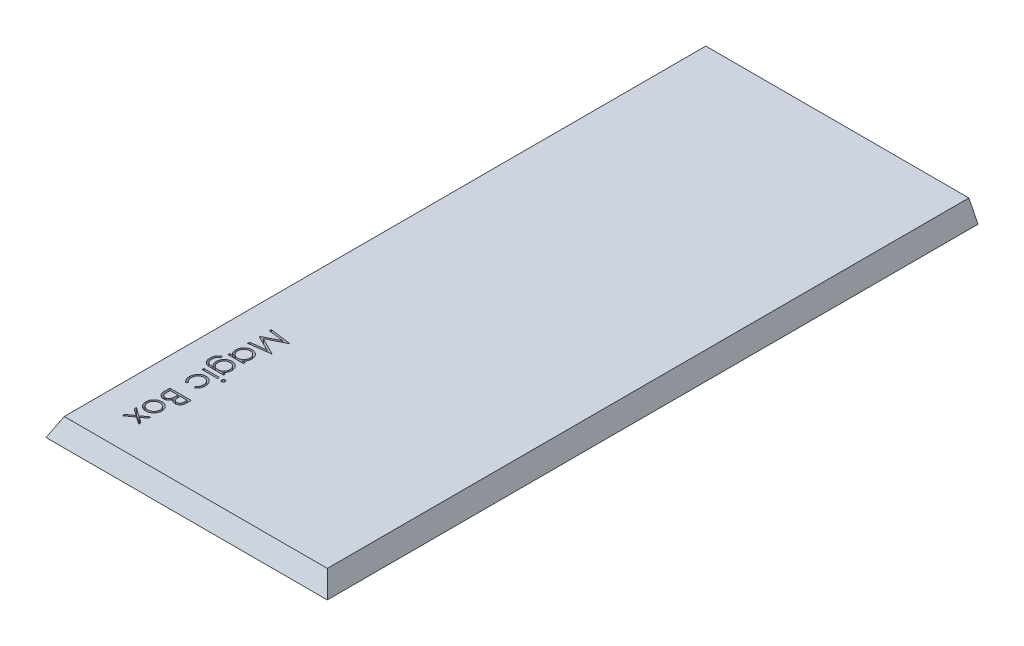
from build123d import *

# Parameters (mm, degrees)
SKETCH1_W           = 47
SKETCH1_H           = 107.5
BOSS_EXTRUDE1_DEPTH = 3
SKETCH2_W           = 2.557692308
SKETCH2_H           = 0.314102564
CUT_EXTRUDE2_DEPTH  = 1
CUT_EXTRUDE7_DEPTH  = 109
CUT_EXTRUDE10_DEPTH = 109


with BuildPart() as part:
    # Sketch1 → Boss-Extrude1 (new body)
    with BuildSketch(Plane(origin=(0, 0, 0), x_dir=(1, 0, 0), z_dir=(0, 1, 0))):
        with Locations((23.5, -53.75)):
            Rectangle(SKETCH1_W, SKETCH1_H)
    extrude(amount=BOSS_EXTRUDE1_DEPTH)

    # Sketch2 → Cut-Extrude2 (cut)
    # profile 1 of 9: a face of its own
    with BuildSketch(Plane(origin=(0, 3, 0), x_dir=(1, 0, 0), z_dir=(0, 1, 0))):
        Polygon((9.057692308, -98.570512821), (9.057692308, -98.944210737), (8.135016026, -99.602564103), (9.057692308, -100.260917468), (9.057692308, -100.634615385), (7.873497596, -99.789763622), (6.5, -100.769230769), (6.5, -100.395532853), (7.611278045, -99.602564103), (6.5, -98.809595353), (6.5, -98.435897436), (7.873497596, -99.416065705), align=None)
    # profile 2 of 9: a face of its own
    with BuildSketch(Plane(origin=(0, 3, 0), x_dir=(1, 0, 0), z_dir=(0, 1, 0))):
        with BuildLine():
            add(Edge.make_bspline(
                [(9.102564103, -96.844350962), (9.10154521, -96.892343426), (9.099547412, -96.986444919), (9.07808998, -97.124235935), (9.045551155, -97.255629662), (8.999748526, -97.381189741), (8.939653687, -97.499877535), (8.866981145, -97.612752731), (8.781239229, -97.71958918), (8.714875573, -97.783609539), (8.681189904, -97.816105769)],
                knots=[0, 0, 0, 0, 1.054042676, 2.066720093, 3.05716247, 4.025731183, 4.997454851, 5.974904663, 6.97207755, 8, 8, 8, 8], degree=3))
            add(Edge.make_bspline(
                [(8.681189904, -97.816105769), (8.648975918, -97.844087723), (8.585171376, -97.899510104), (8.481715763, -97.970575822), (8.374575662, -98.031797382), (8.262328336, -98.080860343), (8.145953664, -98.119545367), (8.025051653, -98.147011063), (7.899889306, -98.163347998), (7.814885468, -98.165550965), (7.771834936, -98.166666667)],
                knots=[0, 0, 0, 0, 1.025258237, 2.030674902, 3.01204498, 3.988269485, 4.97094183, 5.956517959, 6.965070386, 8, 8, 8, 8], degree=3))
            add(Edge.make_bspline(
                [(7.771834936, -98.166666667), (7.728534878, -98.165685329), (7.642971945, -98.163746161), (7.51695258, -98.145402544), (7.394757754, -98.11687146), (7.276899073, -98.076039616), (7.163016196, -98.023681529), (7.053606839, -97.959790755), (6.948453965, -97.883919473), (6.848454996, -97.797914177), (6.75627808, -97.702867146), (6.675988565, -97.599733449), (6.606912047, -97.49046507), (6.552046085, -97.373570388), (6.507820299, -97.250713362), (6.477323772, -97.121112544), (6.458720064, -96.984883549), (6.456342333, -96.891854093), (6.455128205, -96.844350962)],
                knots=[0, 0, 0, 0, 0.998669827, 1.973418153, 2.932281609, 3.89081133, 4.846438734, 5.82045571, 6.809776312, 7.834649874, 8.860672198, 9.859676908, 10.845817165, 11.837296335, 12.833502054, 13.853824644, 14.904110009, 16, 16, 16, 16], degree=3))
            add(Edge.make_bspline(
                [(6.455128205, -96.844350962), (6.456352379, -96.796617378), (6.458749984, -96.703128742), (6.477185387, -96.566386787), (6.508146141, -96.436240309), (6.55149858, -96.312802141), (6.607362699, -96.195907933), (6.675719795, -96.086236079), (6.756318736, -95.983053735), (6.84844398, -95.887976906), (6.948456803, -95.8019796), (7.053606102, -95.726106256), (7.163016387, -95.662216017), (7.276899022, -95.609857791), (7.394757767, -95.569025984), (7.516952576, -95.540494889), (7.642971946, -95.522151275), (7.728534878, -95.520212107), (7.771834936, -95.519230769)],
                knots=[0, 0, 0, 0, 1.099861214, 2.154133753, 3.1731438, 4.178222029, 5.163564916, 6.153006591, 7.15072618, 8.175428628, 9.198983792, 10.187031731, 11.15979573, 12.114193814, 13.071490482, 14.029120454, 15.002614863, 16, 16, 16, 16], degree=3))
            add(Edge.make_bspline(
                [(7.771834936, -95.519230769), (7.814651482, -95.52035408), (7.899420884, -95.522578041), (8.024347945, -95.53889855), (8.145045334, -95.566257107), (8.26097081, -95.604988503), (8.372726246, -95.654503694), (8.480131077, -95.714864982), (8.583118877, -95.786655614), (8.646840957, -95.841857566), (8.679086538, -95.869791667)],
                knots=[0, 0, 0, 0, 1.031353054, 2.041901799, 3.029428768, 4.008703097, 4.981709435, 5.96992636, 6.972712378, 8, 8, 8, 8], degree=3))
            add(Edge.make_bspline(
                [(8.679086538, -95.869791667), (8.713058664, -95.902241594), (8.779870826, -95.966060087), (8.865443569, -96.073389708), (8.939095912, -96.185779355), (8.999160507, -96.305232726), (9.04546805, -96.431141933), (9.078241849, -96.563512205), (9.0994525, -96.701804752), (9.101516565, -96.796362025), (9.102564103, -96.844350962)],
                knots=[0, 0, 0, 0, 1.027951202, 2.021646915, 2.998468564, 3.9668038, 4.943370589, 5.93035926, 6.949632805, 8, 8, 8, 8], degree=3))
        make_face()
        with BuildLine():
            add(Edge.make_bspline(
                [(8.788461538, -96.842948718), (8.787496895, -96.809011145), (8.785592509, -96.742012091), (8.771109357, -96.643391957), (8.74815907, -96.548453836), (8.715565273, -96.457005495), (8.673427645, -96.369400624), (8.621963898, -96.285542833), (8.560899931, -96.205657417), (8.491449449, -96.130358069), (8.416014047, -96.06044067), (8.334897943, -96.000026534), (8.250428202, -95.94856042), (8.162166361, -95.905731049), (8.06927654, -95.873820955), (7.972795205, -95.850648721), (7.872529979, -95.836178268), (7.804368935, -95.834291919), (7.769731571, -95.833333333)],
                knots=[0, 0, 0, 0, 1.021589593, 2.016807015, 2.994807536, 3.958602519, 4.934347097, 5.916793557, 6.916107818, 7.957073844, 8.998039869, 10.008589932, 10.997041759, 11.972786337, 12.956492182, 13.948170289, 14.957322718, 16, 16, 16, 16], degree=3))
            add(Edge.make_bspline(
                [(7.769731571, -95.833333333), (7.724977566, -95.834935917), (7.636149235, -95.838116746), (7.505367193, -95.864114332), (7.379576721, -95.907297533), (7.260292369, -95.966844276), (7.14973484, -96.040177881), (7.050320988, -96.125926492), (6.965884611, -96.225275613), (6.894872197, -96.334842217), (6.838949987, -96.453073604), (6.798846326, -96.577987576), (6.773127506, -96.708446753), (6.770541049, -96.797722349), (6.769230769, -96.842948718)],
                knots=[0, 0, 0, 0, 1.016977094, 2.018509362, 3.018404954, 4.033172147, 5.041280572, 6.028085189, 7.007940189, 7.995502847, 8.989109012, 9.972200833, 10.97273166, 12, 12, 12, 12], degree=3))
            add(Edge.make_bspline(
                [(6.769230769, -96.842948718), (6.770533459, -96.888177688), (6.773104934, -96.977458419), (6.798976626, -97.108099114), (6.838775602, -97.233355435), (6.894935358, -97.351709753), (6.965616203, -97.461326253), (7.050802015, -97.559965953), (7.149473499, -97.64645302), (7.260145777, -97.719859238), (7.379762163, -97.778446518), (7.505344015, -97.821832798), (7.636155138, -97.847768034), (7.724979543, -97.850957279), (7.769731571, -97.852564103)],
                knots=[0, 0, 0, 0, 1.027082318, 2.027431966, 3.015401697, 4.008827937, 4.996211763, 5.971861488, 6.96198607, 7.969911943, 8.982141629, 9.981856156, 10.983207064, 12, 12, 12, 12], degree=3))
            add(Edge.make_bspline(
                [(7.769731571, -97.852564103), (7.8043717, -97.85161265), (7.872538187, -97.849740336), (7.972763828, -97.835167795), (8.069467367, -97.81235552), (8.161792021, -97.779048075), (8.250859277, -97.737688633), (8.334644294, -97.684970546), (8.416065613, -97.624837806), (8.491403982, -97.554792111), (8.561153687, -97.47950124), (8.621741455, -97.399015681), (8.673457034, -97.315118944), (8.715570463, -97.227486387), (8.748033616, -97.136244989), (8.771209332, -97.041595106), (8.785539702, -96.943411708), (8.787481364, -96.876650563), (8.788461538, -96.842948718)],
                knots=[0, 0, 0, 0, 1.043020522, 2.052505155, 3.044509714, 4.030878336, 5.003918577, 5.996372628, 7.007255355, 8.048564058, 9.08987276, 10.095126797, 11.077896669, 12.053962454, 13.01807471, 13.98956039, 14.985105429, 16, 16, 16, 16], degree=3))
        make_face(mode=Mode.SUBTRACT)
    # profile 3 of 9: a face of its own
    with BuildSketch(Plane(origin=(0, 3, 0), x_dir=(1, 0, 0), z_dir=(0, 1, 0))):
        with BuildLine():
            Line((10, -92.916666667), (10, -93.599559295))
            add(Edge.make_bspline(
                [(10, -93.599559295), (9.99982425, -93.632987773), (9.999483602, -93.697780483), (9.99420047, -93.791999925), (9.986996801, -93.880248736), (9.975566708, -93.962552508), (9.961774931, -94.038873211), (9.945073115, -94.109440848), (9.925046501, -94.17403102), (9.89320022, -94.251143757), (9.845877051, -94.339064417), (9.775948486, -94.43426281), (9.690416023, -94.515667049), (9.593933368, -94.585853367), (9.487797596, -94.641654486), (9.374538407, -94.682023784), (9.255616665, -94.707581659), (9.173973487, -94.710210093), (9.13271234, -94.711538462)],
                knots=[0, 0, 0, 0, 1.001505555, 1.941167018, 2.826882275, 3.653841531, 4.429895133, 5.150066043, 5.825578002, 6.45369114, 7.647487171, 8.808567382, 9.977351308, 11.170798116, 12.373658725, 13.556498008, 14.765093433, 16, 16, 16, 16], degree=3))
            add(Edge.make_bspline(
                [(9.13271234, -94.711538462), (9.094053235, -94.710466372), (9.018084448, -94.708359614), (8.907150679, -94.687527962), (8.801116128, -94.656512603), (8.701287981, -94.611487466), (8.608949247, -94.553571207), (8.52464869, -94.483875674), (8.450429264, -94.40089403), (8.409109541, -94.338622368), (8.388120994, -94.306991186)],
                knots=[0, 0, 0, 0, 1.044266239, 2.052081639, 3.041743201, 4.026043445, 5.00270663, 5.980942822, 6.97441044, 8, 8, 8, 8], degree=3))
            add(Edge.make_bspline(
                [(8.388120994, -94.306991186), (8.372867775, -94.346758272), (8.343684588, -94.42284256), (8.291808319, -94.527619875), (8.236021049, -94.618254577), (8.174776106, -94.69484643), (8.107935032, -94.759363213), (8.036836284, -94.817300623), (7.95797957, -94.865839183), (7.87361028, -94.907537897), (7.784320561, -94.940354348), (7.690518767, -94.963574141), (7.593253774, -94.977841573), (7.526957798, -94.97978708), (7.493489583, -94.980769231)],
                knots=[0, 0, 0, 0, 1.272302504, 2.434229863, 3.488457646, 4.447234501, 5.35599188, 6.26022912, 7.18267843, 8.11661068, 9.06895546, 10.019249207, 11.000057067, 12, 12, 12, 12], degree=3))
            add(Edge.make_bspline(
                [(7.493489583, -94.980769231), (7.459322905, -94.979792078), (7.392099008, -94.977869503), (7.293341106, -94.96369391), (7.198976329, -94.93966871), (7.10833373, -94.906656773), (7.021926377, -94.86332724), (6.938672091, -94.811733057), (6.86078871, -94.748936398), (6.786424081, -94.678940632), (6.719600708, -94.599662898), (6.660109352, -94.514140838), (6.610959363, -94.421144363), (6.570188246, -94.322115604), (6.538590839, -94.21639651), (6.516654453, -94.104379064), (6.501839273, -93.986038921), (6.500623494, -93.904828585), (6.5, -93.86318109)],
                knots=[0, 0, 0, 0, 0.978404568, 1.925038397, 2.85041836, 3.763147166, 4.682162379, 5.614488577, 6.562659439, 7.54271123, 8.535210642, 9.526693784, 10.520907202, 11.541451354, 12.589717429, 13.675358278, 14.807842563, 16, 16, 16, 16], degree=3))
            Line((6.5, -93.86318109), (6.5, -92.916666667))
            Line((6.5, -92.916666667), (10, -92.916666667))
        make_face()
        with BuildLine():
            Line((9.641025641, -93.230769231), (8.519230769, -93.230769231))
            Line((8.519230769, -93.230769231), (8.519230769, -93.441806891))
            add(Edge.make_bspline(
                [(8.519230769, -93.441806891), (8.519627364, -93.472655964), (8.520393667, -93.53226266), (8.522657945, -93.618811951), (8.528720383, -93.69894927), (8.535132411, -93.772950755), (8.545005621, -93.840320417), (8.557087658, -93.90128379), (8.569753809, -93.956388516), (8.591355012, -94.019907485), (8.622955643, -94.091937153), (8.673150423, -94.168235466), (8.731312009, -94.23659073), (8.799660574, -94.293666514), (8.874282065, -94.340764013), (8.955183134, -94.372194839), (9.039205431, -94.394488311), (9.097038901, -94.396443304), (9.126402244, -94.397435897)],
                knots=[0, 0, 0, 0, 1.156481963, 2.23455883, 3.244418989, 4.168404366, 5.01828131, 5.794834307, 6.498111525, 7.13526334, 8.307595709, 9.435046769, 10.546766856, 11.659452936, 12.760769924, 13.837671619, 14.902137667, 16, 16, 16, 16], degree=3))
            add(Edge.make_bspline(
                [(9.126402244, -94.397435897), (9.145837164, -94.39693946), (9.183960884, -94.395965643), (9.239322416, -94.387102753), (9.292056229, -94.374242613), (9.34094948, -94.35415115), (9.387391857, -94.32985642), (9.429320542, -94.298253384), (9.469032638, -94.262562842), (9.505070015, -94.220647774), (9.537359647, -94.172711135), (9.56577169, -94.118296178), (9.588183923, -94.056753159), (9.608288888, -93.989477498), (9.622239543, -93.915392507), (9.633904149, -93.835222098), (9.63983359, -93.748286159), (9.640619428, -93.688141232), (9.641025641, -93.657051282)],
                knots=[0, 0, 0, 0, 0.911752476, 1.788502045, 2.626783689, 3.45400582, 4.26402138, 5.080402872, 5.911472738, 6.767166405, 7.66795952, 8.620018292, 9.640966946, 10.73819047, 11.913090943, 13.176185384, 14.540321519, 16, 16, 16, 16], degree=3))
            Line((9.641025641, -93.657051282), (9.641025641, -93.230769231))
        make_face(mode=Mode.SUBTRACT)
        with BuildLine():
            Line((8.16025641, -93.230769231), (6.858974359, -93.230769231))
            Line((6.858974359, -93.230769231), (6.858974359, -93.678084936))
            add(Edge.make_bspline(
                [(6.858974359, -93.678084936), (6.859356766, -93.710104021), (6.860093805, -93.771816585), (6.862526199, -93.860915702), (6.867942779, -93.94327407), (6.876773248, -94.018939081), (6.885948875, -94.088576793), (6.898648387, -94.151495353), (6.913086196, -94.207791221), (6.93542939, -94.273059411), (6.970080688, -94.346602777), (7.022667742, -94.425801578), (7.084492161, -94.496918849), (7.156948104, -94.556618237), (7.235135085, -94.60591565), (7.31864416, -94.640490803), (7.404927716, -94.66272213), (7.463909533, -94.665349174), (7.493489583, -94.666666667)],
                knots=[0, 0, 0, 0, 1.159821618, 2.235403267, 3.228114831, 4.14795534, 4.994323282, 5.771256229, 6.471395042, 7.097801288, 8.267864287, 9.404187171, 10.531774336, 11.667624178, 12.792825787, 13.866573821, 14.930062559, 16, 16, 16, 16], degree=3))
            add(Edge.make_bspline(
                [(7.493489583, -94.666666667), (7.511985316, -94.666397375), (7.548678445, -94.665863136), (7.602559382, -94.657503195), (7.654984973, -94.645840532), (7.705162465, -94.628951993), (7.753908353, -94.607656914), (7.80037356, -94.580932398), (7.845669087, -94.550070645), (7.902867072, -94.501792666), (7.968791298, -94.431637775), (8.033326389, -94.331925284), (8.085374877, -94.2185546), (8.107474256, -94.136326877), (8.118890224, -94.09385016)],
                knots=[0, 0, 0, 0, 0.723503378, 1.435336582, 2.130201219, 2.824764462, 3.504949994, 4.209866579, 4.920640069, 5.648298893, 7.13757748, 8.670694625, 10.280166878, 12, 12, 12, 12], degree=3))
            add(Edge.make_bspline(
                [(8.118890224, -94.09385016), (8.122345541, -94.07682108), (8.129837379, -94.039898522), (8.137740616, -93.979690636), (8.144830077, -93.910724283), (8.14993647, -93.833294237), (8.155418093, -93.747092549), (8.157474037, -93.652146913), (8.159983424, -93.548390205), (8.160163087, -93.476397744), (8.16025641, -93.439002404)],
                knots=[0, 0, 0, 0, 0.634452549, 1.375623993, 2.216454381, 3.166361212, 4.209414599, 5.370755378, 6.634280627, 8, 8, 8, 8], degree=3))
            Line((8.16025641, -93.439002404), (8.16025641, -93.230769231))
        make_face(mode=Mode.SUBTRACT)
    # profile 4 of 9: a face of its own
    with BuildSketch(Plane(origin=(0, 3, 0), x_dir=(1, 0, 0), z_dir=(0, 1, 0))):
        with BuildLine():
            Line((8.503104968, -90.852564103), (8.33974359, -90.589643429))
            add(Edge.make_bspline(
                [(8.33974359, -90.589643429), (8.375575019, -90.560815173), (8.446103104, -90.504071645), (8.537069702, -90.405509438), (8.615517794, -90.300418537), (8.678593404, -90.186817465), (8.728385102, -90.065701546), (8.762989677, -89.93682126), (8.784740583, -89.800216373), (8.787200898, -89.706548292), (8.788461538, -89.658553686)],
                knots=[0, 0, 0, 0, 1.026629843, 2.020746545, 2.988156479, 3.951609825, 4.916760838, 5.907688704, 6.927920211, 8, 8, 8, 8], degree=3))
            add(Edge.make_bspline(
                [(8.788461538, -89.658553686), (8.787404632, -89.620194774), (8.785323084, -89.544647941), (8.772313503, -89.433741142), (8.748668193, -89.328101125), (8.717529159, -89.22705198), (8.675735107, -89.131362526), (8.625181733, -89.040764688), (8.565653632, -88.954955438), (8.497579651, -88.875297933), (8.422809808, -88.802702108), (8.343849662, -88.738497164), (8.260146373, -88.684909597), (8.173288589, -88.64024008), (8.081782059, -88.606631548), (7.986738455, -88.581916661), (7.887532367, -88.566851941), (7.820030561, -88.565026636), (7.785857372, -88.564102564)],
                knots=[0, 0, 0, 0, 1.11253269, 2.191102883, 3.232049486, 4.248096668, 5.252846381, 6.25411548, 7.252444123, 8.276484619, 9.287796331, 10.271127345, 11.222403915, 12.165070373, 13.097940083, 14.043161362, 15.009338842, 16, 16, 16, 16], degree=3))
            add(Edge.make_bspline(
                [(7.785857372, -88.564102564), (7.741086201, -88.565877797), (7.652147111, -88.569404344), (7.520898021, -88.597165293), (7.393761319, -88.642315875), (7.272436265, -88.705324275), (7.159946172, -88.783715683), (7.058232883, -88.875188615), (6.971531271, -88.981772447), (6.898968727, -89.100338856), (6.840401174, -89.22874701), (6.799073636, -89.365978994), (6.773989064, -89.510866168), (6.770837582, -89.610074661), (6.769230769, -89.660657051)],
                knots=[0, 0, 0, 0, 0.966447457, 1.919872872, 2.884287729, 3.873230387, 4.863319139, 5.838939256, 6.818209587, 7.819967013, 8.834377336, 9.85802846, 10.90789553, 12, 12, 12, 12], degree=3))
            add(Edge.make_bspline(
                [(6.769230769, -89.660657051), (6.770530266, -89.707012236), (6.773084123, -89.798112474), (6.794613087, -89.931279759), (6.82985672, -90.05805967), (6.87900437, -90.178447701), (6.942531886, -90.292223867), (7.020891057, -90.398653042), (7.111827657, -90.49985298), (7.182145629, -90.559349956), (7.217948718, -90.589643429)],
                knots=[0, 0, 0, 0, 1.039848629, 2.043578496, 3.018386758, 3.987534228, 4.954977003, 5.934852016, 6.948509513, 8, 8, 8, 8], degree=3))
            Line((7.217948718, -90.589643429), (7.045472756, -90.852564103))
            add(Edge.make_bspline(
                [(7.045472756, -90.852564103), (7.022582216, -90.836976267), (6.976877113, -90.805852334), (6.912430209, -90.753826697), (6.852119037, -90.697699367), (6.795961602, -90.637734126), (6.742972846, -90.574691993), (6.694654445, -90.506932006), (6.649783722, -90.435607715), (6.609120817, -90.360391883), (6.572649661, -90.282025269), (6.541087304, -90.200505483), (6.514401405, -90.116200775), (6.492808188, -90.029300585), (6.475725389, -89.939667779), (6.464363913, -89.847370614), (6.455890744, -89.752426362), (6.455384589, -89.688254302), (6.455128205, -89.655749199)],
                knots=[0, 0, 0, 0, 0.954067324, 1.904967979, 2.850944488, 3.791040077, 4.734579251, 5.686741025, 6.656553487, 7.63677735, 8.631289747, 9.633371755, 10.647134148, 11.676547777, 12.717490898, 13.789379914, 14.88025357, 16, 16, 16, 16], degree=3))
            add(Edge.make_bspline(
                [(6.455128205, -89.655749199), (6.456019485, -89.606138315), (6.4577664, -89.508900624), (6.476974874, -89.366578113), (6.505932495, -89.230564456), (6.547496211, -89.100906061), (6.601001052, -88.977582965), (6.666357724, -88.860709333), (6.744110425, -88.750675248), (6.832869742, -88.648557136), (6.929123096, -88.554802675), (7.032927558, -88.474180004), (7.14082011, -88.404625152), (7.254057284, -88.347264267), (7.373067504, -88.30393329), (7.496919148, -88.273094746), (7.62560932, -88.253460815), (7.713336996, -88.25116428), (7.7578125, -88.25)],
                knots=[0, 0, 0, 0, 1.112900083, 2.181292239, 3.217426397, 4.231060065, 5.231907716, 6.230057215, 7.231385915, 8.250448267, 9.26326716, 10.242335464, 11.195469137, 12.140906363, 13.085222324, 14.031808558, 15.002181388, 16, 16, 16, 16], degree=3))
            add(Edge.make_bspline(
                [(7.7578125, -88.25), (7.787986107, -88.250467846), (7.848006391, -88.251398469), (7.937210332, -88.261068641), (8.024834339, -88.275552302), (8.110752657, -88.296114353), (8.195225183, -88.32191637), (8.277800789, -88.354344549), (8.358959941, -88.392294733), (8.437703339, -88.436446985), (8.513554146, -88.485149819), (8.586080502, -88.538073343), (8.653424895, -88.596127551), (8.717272774, -88.658084288), (8.77571789, -88.724882208), (8.83128528, -88.795276889), (8.88109605, -88.871005462), (8.927609275, -88.950137881), (8.968951856, -89.032776383), (9.004589631, -89.118339341), (9.035040988, -89.206333368), (9.059150238, -89.296893241), (9.079367572, -89.389419488), (9.092085442, -89.484640806), (9.101071709, -89.582193033), (9.102062502, -89.648249055), (9.102564103, -89.681690705)],
                knots=[0, 0, 0, 0, 0.991083503, 1.971428668, 2.944771278, 3.907728914, 4.872032831, 5.84458753, 6.820199395, 7.813689706, 8.808455339, 9.780676499, 10.761021664, 11.727616056, 12.70141294, 13.675300653, 14.672050164, 15.67696011, 16.690052069, 17.705469636, 18.720567748, 19.746988726, 20.783187267, 21.830086354, 22.901455311, 24, 24, 24, 24], degree=3))
            add(Edge.make_bspline(
                [(9.102564103, -89.681690705), (9.101642457, -89.723570931), (9.099803771, -89.807122045), (9.08432148, -89.931061004), (9.06099875, -90.053182772), (9.026375122, -90.171305473), (8.984767812, -90.28394002), (8.93714288, -90.389169575), (8.88318024, -90.485344205), (8.823192746, -90.57335735), (8.755871557, -90.653558441), (8.680053861, -90.726807101), (8.596198315, -90.794640343), (8.534392181, -90.833096836), (8.503104968, -90.852564103)],
                knots=[0, 0, 0, 0, 1.095247575, 2.185020588, 3.262981163, 4.344680461, 5.40090428, 6.402280576, 7.363136638, 8.282296962, 9.184898179, 10.097200524, 11.036773704, 12, 12, 12, 12], degree=3))
        make_face()
    # profile 5 of 9: a face of its own
    with BuildSketch(Plane(origin=(0, 3, 0), x_dir=(1, 0, 0), z_dir=(0, 1, 0))):
        with BuildLine():
            add(Edge.make_bspline(
                [(10.134615385, -87.463341346), (10.13370731, -87.482829408), (10.131929126, -87.520990775), (10.116823357, -87.576230268), (10.090827583, -87.626479065), (10.057084436, -87.671713656), (10.015769317, -87.709211052), (9.96882621, -87.736098682), (9.91772133, -87.753263662), (9.882112539, -87.755348675), (9.863982372, -87.756410256)],
                knots=[0, 0, 0, 0, 1.054986045, 2.065865298, 3.074122704, 4.105114675, 5.109626121, 6.074217918, 7.019490725, 8, 8, 8, 8], degree=3))
            add(Edge.make_bspline(
                [(9.863982372, -87.756410256), (9.846322808, -87.755324927), (9.811411939, -87.753179358), (9.761193153, -87.73611137), (9.714903719, -87.708985631), (9.673669374, -87.671738614), (9.63994572, -87.626472473), (9.613944797, -87.576232012), (9.598840388, -87.520990316), (9.597062016, -87.482829252), (9.596153846, -87.463341346)],
                knots=[0, 0, 0, 0, 0.961106377, 1.899993565, 2.859409042, 3.870007927, 4.90724781, 5.921615355, 6.938620636, 8, 8, 8, 8], degree=3))
            add(Edge.make_bspline(
                [(9.596153846, -87.463341346), (9.597032849, -87.444077263), (9.598743713, -87.406582242), (9.614125508, -87.35235844), (9.639889179, -87.302918165), (9.674136064, -87.258423329), (9.714629537, -87.220437835), (9.761228119, -87.193412183), (9.811403037, -87.176298561), (9.846319817, -87.174159142), (9.863982372, -87.173076923)],
                knots=[0, 0, 0, 0, 1.055304112, 2.054011575, 3.063363921, 4.096942562, 5.122536081, 6.088009498, 7.032825006, 8, 8, 8, 8], degree=3))
            add(Edge.make_bspline(
                [(9.863982372, -87.173076923), (9.882115643, -87.174135278), (9.917730531, -87.176213954), (9.968790647, -87.193425465), (10.016045838, -87.220209634), (10.056618084, -87.258447872), (10.090884, -87.302911739), (10.116642695, -87.352360113), (10.13202579, -87.406581798), (10.133736474, -87.444077112), (10.134615385, -87.463341346)],
                knots=[0, 0, 0, 0, 0.986662878, 1.937868148, 2.908513651, 3.927890639, 4.955204348, 5.958438607, 6.951092507, 8, 8, 8, 8], degree=3))
        make_face()
    # profile 6 of 9: a face of its own
    with BuildSketch(Plane(origin=(0, 3, 0), x_dir=(1, 0, 0), z_dir=(0, 1, 0))):
        with Locations((7.778846154, -87.46474359)):
            Rectangle(SKETCH2_W, SKETCH2_H)
    # profile 7 of 9: a face of its own
    with BuildSketch(Plane(origin=(0, 3, 0), x_dir=(1, 0, 0), z_dir=(0, 1, 0))):
        with BuildLine():
            Line((9.057692308, -86.320512821), (9.057692308, -86.634615385))
            Line((9.057692308, -86.634615385), (7.027944712, -86.634615385))
            add(Edge.make_bspline(
                [(7.027944712, -86.634615385), (6.984707117, -86.634338342), (6.901248144, -86.633803583), (6.780569865, -86.629952612), (6.669103779, -86.621831935), (6.56634152, -86.612623253), (6.47275941, -86.599376537), (6.388078206, -86.58320017), (6.312216643, -86.564964491), (6.265491802, -86.548944273), (6.243389423, -86.541366186)],
                knots=[0, 0, 0, 0, 1.307562039, 2.523909702, 3.650326591, 4.686913197, 5.643429486, 6.506965704, 7.293745905, 8, 8, 8, 8], degree=3))
            add(Edge.make_bspline(
                [(6.243389423, -86.541366186), (6.214658501, -86.530178031), (6.158055694, -86.508136239), (6.07783573, -86.466835051), (6.002236129, -86.420658797), (5.932120714, -86.367732544), (5.866386321, -86.309395253), (5.806180809, -86.244575685), (5.750569786, -86.174426388), (5.700653499, -86.098376494), (5.656913632, -86.017196434), (5.618199005, -85.931965895), (5.58476255, -85.842931268), (5.559665852, -85.749236154), (5.537934986, -85.652303763), (5.523789223, -85.551006934), (5.514162463, -85.445933971), (5.513272189, -85.374488614), (5.512820513, -85.338241186)],
                knots=[0, 0, 0, 0, 0.981884813, 1.934411902, 2.870642727, 3.801527012, 4.729816098, 5.667674509, 6.616731011, 7.579249157, 8.562291171, 9.552107921, 10.560574871, 11.588648803, 12.640348669, 13.724070705, 14.845319185, 16, 16, 16, 16], degree=3))
            add(Edge.make_bspline(
                [(5.512820513, -85.338241186), (5.5136751, -85.285355926), (5.515344339, -85.182056804), (5.534861724, -85.03145914), (5.56227927, -84.888617701), (5.604214713, -84.755340142), (5.655320026, -84.632141517), (5.713527987, -84.519574681), (5.780944291, -84.419491043), (5.857416405, -84.329352176), (5.948388025, -84.24801482), (6.055584472, -84.171486251), (6.180652094, -84.0978257), (6.272444699, -84.054657004), (6.320512821, -84.032051282)],
                knots=[0, 0, 0, 0, 1.157931887, 2.261752077, 3.322178827, 4.340878186, 5.316509817, 6.24181319, 7.112369066, 7.954886437, 8.824930176, 9.778504873, 10.836691706, 12, 12, 12, 12], degree=3))
            Line((6.320512821, -84.032051282), (6.320512821, -84.346153846))
            add(Edge.make_bspline(
                [(6.320512821, -84.346153846), (6.280406945, -84.371416055), (6.202004896, -84.420800564), (6.10049174, -84.513149045), (6.013738376, -84.614355371), (5.943827602, -84.727835054), (5.89111781, -84.85406027), (5.853542514, -84.993106956), (5.831046247, -85.146106578), (5.828334953, -85.252624792), (5.826923077, -85.308092949)],
                knots=[0, 0, 0, 0, 0.997731894, 1.950442991, 2.880492273, 3.800895997, 4.748200782, 5.754801363, 6.83083817, 8, 8, 8, 8], degree=3))
            add(Edge.make_bspline(
                [(5.826923077, -85.308092949), (5.828346724, -85.362861265), (5.831091373, -85.468449098), (5.85365364, -85.620484703), (5.891023453, -85.759355652), (5.943539756, -85.884018872), (6.008401054, -85.992591133), (6.080162299, -86.086512522), (6.161371604, -86.162640218), (6.236146931, -86.213857072), (6.30277195, -86.245691156), (6.360124341, -86.265963515), (6.424977282, -86.282437447), (6.497112999, -86.296217296), (6.576634662, -86.307588206), (6.663724063, -86.314791089), (6.758183286, -86.319996901), (6.823676424, -86.320336871), (6.857572115, -86.320512821)],
                knots=[0, 0, 0, 0, 1.570672572, 3.028099501, 4.397683431, 5.686589315, 6.895122698, 8.017723291, 9.066023084, 10.075791025, 10.603605416, 11.180458235, 11.81795017, 12.521450677, 13.286658401, 14.121327423, 15.027701111, 16, 16, 16, 16], degree=3))
            Line((6.857572115, -86.320512821), (6.990084135, -86.320512821))
            add(Edge.make_bspline(
                [(6.990084135, -86.320512821), (6.952142332, -86.288631703), (6.876926113, -86.225430247), (6.778364476, -86.11628292), (6.693478346, -85.997066005), (6.623859711, -85.867982462), (6.568178287, -85.73219422), (6.529235326, -85.59117199), (6.504075426, -85.446179934), (6.50136811, -85.347927785), (6.5, -85.298277244)],
                knots=[0, 0, 0, 0, 1.012485704, 2.007162095, 2.997754123, 3.998611389, 4.999708251, 5.992315798, 6.98544096, 8, 8, 8, 8], degree=3))
            add(Edge.make_bspline(
                [(6.5, -85.298277244), (6.500515026, -85.269040974), (6.501538985, -85.210914417), (6.510497762, -85.124559669), (6.523496504, -85.039479231), (6.542577943, -84.955871528), (6.56706967, -84.873615914), (6.59768641, -84.792848324), (6.632301523, -84.712914789), (6.673074345, -84.635268323), (6.718436581, -84.560682075), (6.767575731, -84.489719316), (6.820233071, -84.422749218), (6.876933506, -84.360418472), (6.937574176, -84.302774665), (7.001585649, -84.249169534), (7.069471468, -84.200087688), (7.141258055, -84.15616524), (7.215195171, -84.116037734), (7.291636971, -84.081681311), (7.370099853, -84.053161061), (7.449602913, -84.028025952), (7.53159592, -84.010227189), (7.615107085, -83.996617216), (7.700645896, -83.988981142), (7.758266105, -83.987782582), (7.787259615, -83.987179487)],
                knots=[0, 0, 0, 0, 1.028796061, 2.045417375, 3.052978994, 4.056772505, 5.061374657, 6.071351207, 7.095367434, 8.125609542, 9.155490328, 10.16637099, 11.162041966, 12.151987513, 13.129482149, 14.104793677, 15.088808581, 16.075021637, 17.065069715, 18.0481558, 19.021557435, 20.00254184, 20.980451754, 21.971763498, 22.979425854, 24, 24, 24, 24], degree=3))
            add(Edge.make_bspline(
                [(7.787259615, -83.987179487), (7.81626285, -83.98769829), (7.874156986, -83.988733887), (7.96003431, -83.997690259), (8.04477144, -84.010438318), (8.127448989, -84.030720888), (8.209260527, -84.054787546), (8.288874113, -84.086001012), (8.367343356, -84.121962905), (8.44398013, -84.163065633), (8.518079371, -84.209075739), (8.588123447, -84.259720464), (8.654694979, -84.313941081), (8.716940122, -84.372828763), (8.775325427, -84.436035414), (8.829338558, -84.503744767), (8.879955814, -84.575203728), (8.92606627, -84.650657047), (8.966848753, -84.728934149), (9.004061288, -84.808048042), (9.033595424, -84.889046257), (9.059618519, -84.970418802), (9.078053715, -85.053598715), (9.092275956, -85.137566109), (9.100940678, -85.222608447), (9.102022263, -85.279561342), (9.102564103, -85.308092949)],
                knots=[0, 0, 0, 0, 1.008914434, 2.013921196, 3.001938835, 3.98818112, 4.973517748, 5.967241793, 6.960633033, 7.975722852, 8.991170928, 9.993245185, 10.981396684, 11.976616977, 12.972235889, 13.973022409, 14.988340224, 16.01763096, 17.047082309, 18.058647952, 19.057085865, 20.044802253, 21.029198803, 22.0185208, 23.007341325, 24, 24, 24, 24], degree=3))
            add(Edge.make_bspline(
                [(9.102564103, -85.308092949), (9.101228569, -85.355147686), (9.098597863, -85.447835102), (9.077315355, -85.584509997), (9.044144221, -85.716537769), (8.995923726, -85.844594754), (8.93066807, -85.969462599), (8.843609167, -86.090389798), (8.736466658, -86.20944654), (8.653476886, -86.282547986), (8.610376603, -86.320512821)],
                knots=[0, 0, 0, 0, 0.967343326, 1.905452219, 2.838102277, 3.762990896, 4.713322225, 5.726933809, 6.819495538, 8, 8, 8, 8], degree=3))
            Line((8.610376603, -86.320512821), (9.057692308, -86.320512821))
        make_face()
        with BuildLine():
            add(Edge.make_bspline(
                [(8.788461538, -85.333333333), (8.786900487, -85.28740261), (8.783809935, -85.196469517), (8.757425021, -85.063181459), (8.716079879, -84.934503451), (8.65693439, -84.812902095), (8.584850765, -84.698979948), (8.497471728, -84.597960029), (8.397967678, -84.509436833), (8.286294145, -84.435481766), (8.166365493, -84.376057378), (8.040115894, -84.332854287), (7.909000032, -84.305859211), (7.819639175, -84.302815023), (7.774639423, -84.301282051)],
                knots=[0, 0, 0, 0, 1.026331696, 2.03191913, 3.02692423, 4.041490544, 5.047661868, 6.033509946, 7.018359977, 8.017132933, 9.01989117, 10.003339456, 10.994534818, 12, 12, 12, 12], degree=3))
            add(Edge.make_bspline(
                [(7.774639423, -84.301282051), (7.740705946, -84.302007477), (7.673968721, -84.303434177), (7.576033737, -84.317162476), (7.482742814, -84.339326237), (7.394152687, -84.370825463), (7.309414589, -84.409599402), (7.230095282, -84.459541593), (7.154739408, -84.51701997), (7.084895643, -84.582950922), (7.021188158, -84.655489644), (6.965502323, -84.734118231), (6.919331809, -84.818406061), (6.880020229, -84.907006325), (6.851100864, -85.001794801), (6.829073383, -85.101350134), (6.816461499, -85.206340101), (6.814899135, -85.277912081), (6.814102564, -85.314403045)],
                knots=[0, 0, 0, 0, 1.039892369, 2.045164194, 3.025377528, 3.974939947, 4.923826224, 5.876304068, 6.842270891, 7.825700405, 8.815919897, 9.798017152, 10.773083594, 11.758208475, 12.764450271, 13.80592145, 14.881349344, 16, 16, 16, 16], degree=3))
            add(Edge.make_bspline(
                [(6.814102564, -85.314403045), (6.814870173, -85.351366803), (6.816371224, -85.423649041), (6.829274724, -85.529219975), (6.850096696, -85.629252725), (6.879659737, -85.723655511), (6.91738143, -85.812784985), (6.965118259, -85.895639109), (7.019481905, -85.973997389), (7.08289686, -86.045346946), (7.152770925, -86.10989658), (7.22885609, -86.166033505), (7.309684, -86.214246228), (7.396285169, -86.25261868), (7.487515222, -86.284271435), (7.584912477, -86.304226577), (7.687043424, -86.31853845), (7.757057318, -86.319844693), (7.79286859, -86.320512821)],
                knots=[0, 0, 0, 0, 1.121992135, 2.194043731, 3.223932285, 4.220423016, 5.193184374, 6.156086365, 7.118779155, 8.084057622, 9.048292205, 10.002025119, 10.950065319, 11.899697616, 12.87359713, 13.875731462, 14.913461982, 16, 16, 16, 16], degree=3))
            add(Edge.make_bspline(
                [(7.79286859, -86.320512821), (7.839486444, -86.319173253), (7.930561351, -86.316556208), (8.063268109, -86.291859047), (8.18803682, -86.252038848), (8.30447266, -86.196192053), (8.41134271, -86.126210201), (8.506664706, -86.041918775), (8.59057255, -85.944774927), (8.660443783, -85.835044403), (8.717106339, -85.716828372), (8.759055984, -85.593183331), (8.783371668, -85.464457959), (8.78675216, -85.377370127), (8.788461538, -85.333333333)],
                knots=[0, 0, 0, 0, 1.070930318, 2.092221514, 3.091405799, 4.074392322, 5.052047932, 6.019043127, 6.99061078, 7.993717296, 9.000730765, 9.998165278, 10.987753177, 12, 12, 12, 12], degree=3))
        make_face(mode=Mode.SUBTRACT)
    # profile 8 of 9: a face of its own
    with BuildSketch(Plane(origin=(0, 3, 0), x_dir=(1, 0, 0), z_dir=(0, 1, 0))):
        with BuildLine():
            Line((9.057692308, -83.358974359), (6.5, -83.358974359))
            Line((6.5, -83.358974359), (6.5, -83.044871795))
            Line((6.5, -83.044871795), (6.942407853, -83.044871795))
            add(Edge.make_bspline(
                [(6.942407853, -83.044871795), (6.902357452, -83.009460411), (6.82419859, -82.940354649), (6.722394827, -82.824954663), (6.637553673, -82.703139545), (6.569666853, -82.574497373), (6.518284474, -82.43941304), (6.482150896, -82.298271772), (6.458628923, -82.151261676), (6.45630558, -82.05100586), (6.455128205, -82.000200321)],
                knots=[0, 0, 0, 0, 1.074295371, 2.096500925, 3.086030275, 4.053105238, 5.014108356, 5.985331429, 6.979048527, 8, 8, 8, 8], degree=3))
            add(Edge.make_bspline(
                [(6.455128205, -82.000200321), (6.456354374, -81.955032244), (6.458772433, -81.865958797), (6.477537663, -81.734931485), (6.507657479, -81.608832718), (6.549598139, -81.487582132), (6.60494392, -81.372001299), (6.671919959, -81.26143895), (6.75089654, -81.155637054), (6.841535176, -81.056607741), (6.939877501, -80.965300261), (7.045073941, -80.885415437), (7.155679624, -80.817710449), (7.271663464, -80.762069074), (7.392940677, -80.71901086), (7.519428064, -80.689053994), (7.650915158, -80.670308986), (7.740455063, -80.667892152), (7.785857372, -80.666666667)],
                knots=[0, 0, 0, 0, 1.034036272, 2.039165313, 3.024406509, 3.999331371, 4.971254918, 5.953351348, 6.95522652, 7.989525907, 9.023492927, 10.024309745, 11.009187477, 11.988246066, 12.964946762, 13.950187958, 14.960617622, 16, 16, 16, 16], degree=3))
            add(Edge.make_bspline(
                [(7.785857372, -80.666666667), (7.830321265, -80.667919333), (7.918223983, -80.670395786), (8.047499942, -80.688853417), (8.172028314, -80.719868143), (8.291347799, -80.763476311), (8.405938937, -80.819147275), (8.514905164, -80.888016636), (8.619913357, -80.967872673), (8.71759609, -81.060155999), (8.807499363, -81.160074137), (8.886667873, -81.266467984), (8.953472192, -81.378010916), (9.007777609, -81.494926592), (9.050931998, -81.616387147), (9.081014763, -81.74331525), (9.098698613, -81.875133684), (9.101263226, -81.964623236), (9.102564103, -82.010016026)],
                knots=[0, 0, 0, 0, 1.02050356, 2.017480486, 2.990790918, 3.96161403, 4.928589988, 5.909588639, 6.91611943, 7.952353252, 8.989586576, 9.99823133, 10.991940466, 11.968822692, 12.952985106, 13.945868367, 14.958059758, 16, 16, 16, 16], degree=3))
            add(Edge.make_bspline(
                [(9.102564103, -82.010016026), (9.101133352, -82.062217917), (9.098327716, -82.164583361), (9.074730898, -82.314505747), (9.0353558, -82.456463907), (8.981240021, -82.591276106), (8.909860859, -82.718419375), (8.819006253, -82.836328919), (8.710751775, -82.947378448), (8.627359309, -83.011742162), (8.584435096, -83.044871795)],
                knots=[0, 0, 0, 0, 1.03879612, 2.037030165, 3.012306674, 3.966139504, 4.922386257, 5.905048148, 6.921675258, 8, 8, 8, 8], degree=3))
            Line((8.584435096, -83.044871795), (9.057692308, -83.044871795))
            Line((9.057692308, -83.044871795), (9.057692308, -83.358974359))
        make_face()
        with BuildLine():
            add(Edge.make_bspline(
                [(8.788461538, -82.014222756), (8.786827918, -81.968308391), (8.783603412, -81.877680736), (8.758429663, -81.744637134), (8.716546024, -81.617322218), (8.659260529, -81.496381793), (8.587245119, -81.383692629), (8.500074446, -81.283076432), (8.400520567, -81.193329435), (8.287746484, -81.119128166), (8.168225935, -81.056569114), (8.042337959, -81.013669136), (7.913575056, -80.985122098), (7.826206752, -80.982223965), (7.782351763, -80.980769231)],
                knots=[0, 0, 0, 0, 1.031093775, 2.03521511, 3.029845951, 4.035119871, 5.034286494, 6.024708811, 7.017619509, 8.03559408, 9.050082311, 10.039808432, 11.016071318, 12, 12, 12, 12], degree=3))
            add(Edge.make_bspline(
                [(7.782351763, -80.980769231), (7.738767492, -80.982651315), (7.651769786, -80.986408107), (7.522624311, -81.012916657), (7.397243126, -81.058846987), (7.276066955, -81.119978122), (7.16306139, -81.195843784), (7.061560746, -81.284845939), (6.974040482, -81.386745176), (6.900785993, -81.499678772), (6.841819613, -81.620113948), (6.800239861, -81.746825589), (6.773984486, -81.877587334), (6.770820672, -81.9666579), (6.769230769, -82.011418269)],
                knots=[0, 0, 0, 0, 0.979154363, 1.954470772, 2.947816011, 3.971783346, 4.997163654, 5.998045606, 6.995988793, 8.00538986, 9.015323546, 10.000094788, 10.994993517, 12, 12, 12, 12], degree=3))
            add(Edge.make_bspline(
                [(6.769230769, -82.011418269), (6.770865873, -82.056870172), (6.774109662, -82.147039587), (6.799704414, -82.280396327), (6.841067285, -82.410011261), (6.899172696, -82.533956324), (6.970855123, -82.649334775), (7.055144025, -82.752756882), (7.152350119, -82.841067684), (7.260039451, -82.915099938), (7.377544377, -82.973581707), (7.503184173, -83.014829656), (7.635971494, -83.040163602), (7.726849293, -83.043280697), (7.773237179, -83.044871795)],
                knots=[0, 0, 0, 0, 1.017484689, 2.018529338, 3.030031036, 4.058138743, 5.076350332, 6.065651025, 7.036469986, 8.00785331, 8.984076697, 9.96571663, 10.961615403, 12, 12, 12, 12], degree=3))
            add(Edge.make_bspline(
                [(7.773237179, -83.044871795), (7.808574996, -83.043912123), (7.878131003, -83.042023186), (7.980258715, -83.027592833), (8.077991728, -83.004637113), (8.171437013, -82.972293831), (8.260062376, -82.929791811), (8.344562515, -82.878584505), (8.424150324, -82.817621577), (8.498725013, -82.748758284), (8.566404356, -82.672531254), (8.626056362, -82.591473686), (8.676538373, -82.505789521), (8.716937187, -82.415538905), (8.749849087, -82.321416953), (8.771586828, -82.222521526), (8.786560777, -82.119849307), (8.78782128, -82.049802319), (8.788461538, -82.014222756)],
                knots=[0, 0, 0, 0, 1.050062701, 2.066855696, 3.059271411, 4.030305351, 4.999747758, 5.975466543, 6.961907836, 7.974539719, 8.98812422, 9.98710676, 10.961662635, 11.93785114, 12.922015094, 13.919620009, 14.94329489, 16, 16, 16, 16], degree=3))
        make_face(mode=Mode.SUBTRACT)
    # profile 9 of 9: a face of its own
    with BuildSketch(Plane(origin=(0, 3, 0), x_dir=(1, 0, 0), z_dir=(0, 1, 0))):
        Polygon((6.5, -76.224358974), (10, -76.686398237), (10, -76.731270032), (7.128205128, -78.176282051), (10, -79.617788462), (10, -79.663361378), (6.5, -80.128205128), (6.5, -79.812700321), (9.018429487, -79.477564103), (6.5, -78.214142628), (6.5, -78.143329327), (9.024038462, -76.875), (6.5, -76.540564904), align=None)
    extrude(amount=-CUT_EXTRUDE2_DEPTH, mode=Mode.SUBTRACT)

    # Sketch4 → Cut-Extrude7 (cut)
    with BuildSketch(Plane.ZY):
        Polygon((107.8, 3.3), (105.514589803, 3.3), (107.8, -1.270820393), align=None)
    extrude(amount=-CUT_EXTRUDE7_DEPTH, mode=Mode.SUBTRACT)

    # Sketch3 → Cut-Extrude10 (cut)
    with BuildSketch(Plane(origin=(0, 0, 0), x_dir=(-1, 0, 0), z_dir=(0, 0, -1))):
        Polygon((-45.5, 3), (-45.164589803, 3), (-45.014589803, 3.3), (-47.3, 3.3), (-47.3, -1.270820393), (-46.664589803, 0), (-47, 0), (-47, 3), align=None)
        Polygon((-46.664589803, 0), (-45.164589803, 3), (-45.5, 3), (-47, 0), align=None)
        Polygon((-47, 0), (-45.5, 3), (-47, 3), align=None)
        Polygon((-1.5, 3), (-1.835410197, 3), (-0.335410197, 0), (0, 0), align=None)
        Polygon((0, 3), (-1.5, 3), (0, 0), align=None)
    extrude(amount=-CUT_EXTRUDE10_DEPTH, mode=Mode.SUBTRACT)


solid = part.part
